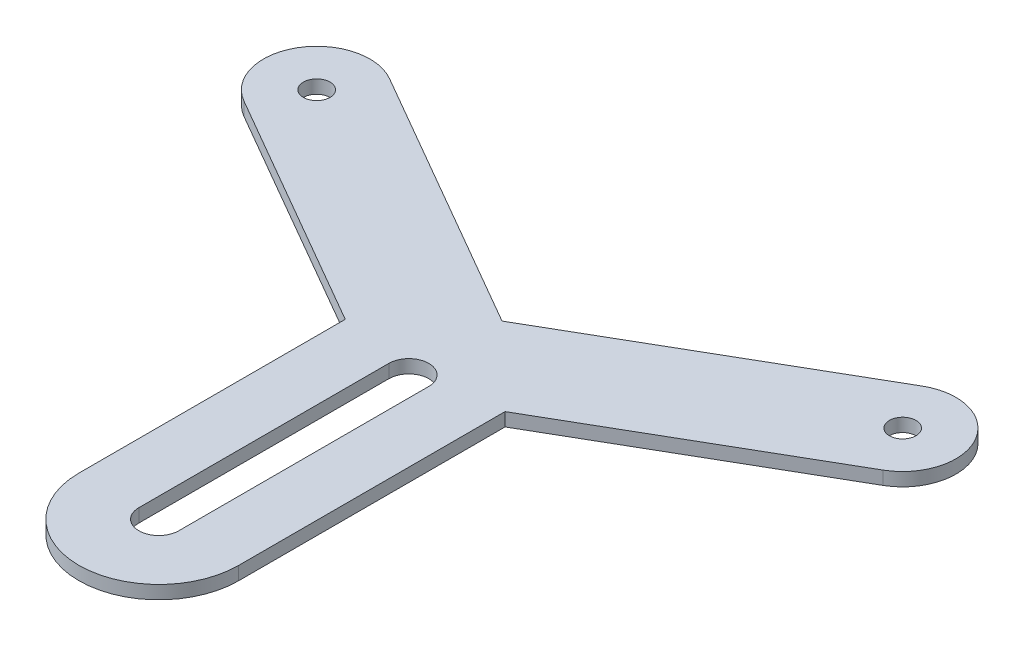
from build123d import *

# Parameters (mm, degrees)
SKETCH1_R           = 6.35
BOSS_EXTRUDE1_DEPTH = 6.35


with BuildPart() as part:
    # Sketch1 → Boss-Extrude1 (new body)
    with BuildSketch(Plane(origin=(0, 0, 0), x_dir=(1, 0, 0), z_dir=(0, 1, 0))):
        with BuildLine():
            Line((-127, 21.997045256), (0, -51.326438931))
            Line((0, -51.326438931), (127, 21.997045256))
            ThreePointArc((127, 21.997045256), (161.697045256, 12.7), (152.4, -21.997045256))
            Line((152.4, -21.997045256), (38.1, -87.988181024))
            Line((38.1, -87.988181024), (38.1, -214.988181024))
            ThreePointArc((38.1, -214.988181024), (0, -253.088181024), (-38.1, -214.988181024))
            Line((-38.1, -214.988181024), (-38.1, -87.988181024))
            Line((-38.1, -87.988181024), (-152.4, -21.997045256))
            ThreePointArc((-152.4, -21.997045256), (-161.697045256, 12.7), (-127, 21.997045256))
        make_face()
        with Locations(Location((-139.7, 0, 0), (0, 0, 270))):
            Circle(SKETCH1_R, mode=Mode.SUBTRACT)
        with Locations(Location((139.7, 0, 0), (0, 0, 270))):
            Circle(SKETCH1_R, mode=Mode.SUBTRACT)
        with BuildLine():
            Line((-9.525, -214.988181024), (-9.525, -95.776438931))
            ThreePointArc((-9.525, -95.776438931), (0, -86.251438931), (9.525, -95.776438931))
            Line((9.525, -95.776438931), (9.525, -214.988181024))
            ThreePointArc((9.525, -214.988181024), (0, -224.513181024), (-9.525, -214.988181024))
        make_face(mode=Mode.SUBTRACT)
    extrude(amount=BOSS_EXTRUDE1_DEPTH)


solid = part.part
